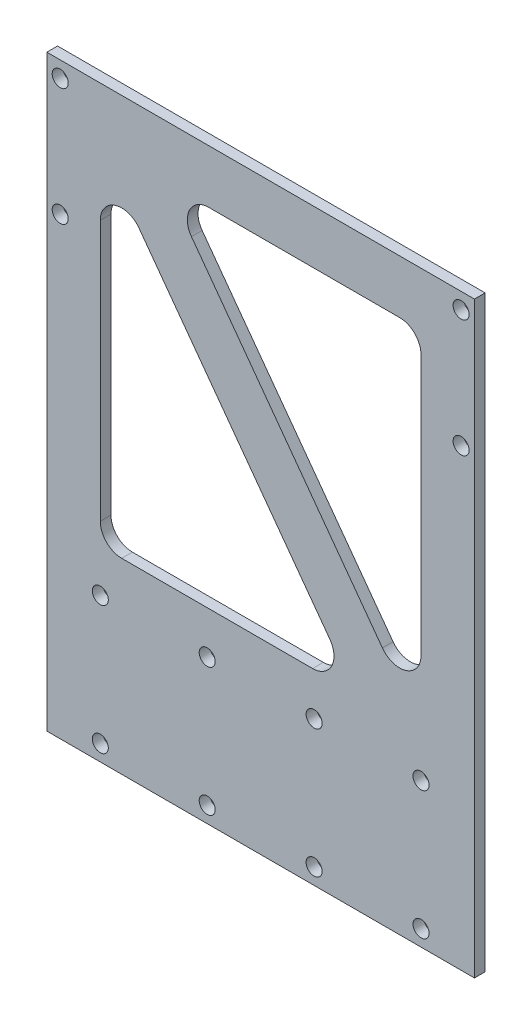
from build123d import *

# Parameters (mm, degrees)
SKETCH_1_W          = 80
SKETCH_1_H          = 110
SKETCH_1_R          = 1.5
EXTRUDE_1_DEPTH     = 2
CUT_EXTRUDE_1_DEPTH = 10
FILLET_1_R          = 4


with BuildPart() as part:
    # 草图1 → 凸台-拉伸1 (new body)
    with BuildSketch(Plane.XY):
        with Locations((40, 55)):
            Rectangle(SKETCH_1_W, SKETCH_1_H)
        with Locations((10, 3)):
            Circle(SKETCH_1_R, mode=Mode.SUBTRACT)
        with Locations((30, 3)):
            Circle(SKETCH_1_R, mode=Mode.SUBTRACT)
        with Locations(Location((50, 3, 0), (0, 0, 180))):
            Circle(SKETCH_1_R, mode=Mode.SUBTRACT)
        with Locations(Location((70, 3, 0), (0, 0, 180))):
            Circle(SKETCH_1_R, mode=Mode.SUBTRACT)
        with Locations((2.5, 107)):
            Circle(SKETCH_1_R, mode=Mode.SUBTRACT)
        with Locations((2.5, 85)):
            Circle(SKETCH_1_R, mode=Mode.SUBTRACT)
        with Locations(Location((77.5, 85, 0), (0, 0, 180))):
            Circle(SKETCH_1_R, mode=Mode.SUBTRACT)
        with Locations(Location((77.5, 107, 0), (0, 0, 180))):
            Circle(SKETCH_1_R, mode=Mode.SUBTRACT)
        with Locations((10, 27)):
            Circle(SKETCH_1_R, mode=Mode.SUBTRACT)
        with Locations((30, 27)):
            Circle(SKETCH_1_R, mode=Mode.SUBTRACT)
        with Locations(Location((50, 27, 0), (0, 0, 180))):
            Circle(SKETCH_1_R, mode=Mode.SUBTRACT)
        with Locations(Location((70, 27, 0), (0, 0, 180))):
            Circle(SKETCH_1_R, mode=Mode.SUBTRACT)
    extrude(amount=EXTRUDE_1_DEPTH)

    # 草图3 → 切除-拉伸1 (cut)
    with BuildSketch(Plane.XY.offset(2)):
        Polygon((10, 100), (10, 35), (57.604900254, 35), align=None)
        Polygon((22.395099746, 100), (70, 35), (70, 100), align=None)
    extrude(amount=-CUT_EXTRUDE_1_DEPTH, mode=Mode.SUBTRACT)

    # 圆角1
    fillet_1_edges = [part.edges().sort_by_distance(p)[0] for p in [
        (22.395099746, 100, 1),
        (70, 100, 1),
        (70, 35, 1),
        (10, 100, 1),
        (57.604900254, 35, 1),
        (10, 35, 1),
    ]]
    fillet(fillet_1_edges, radius=FILLET_1_R)


solid = part.part
